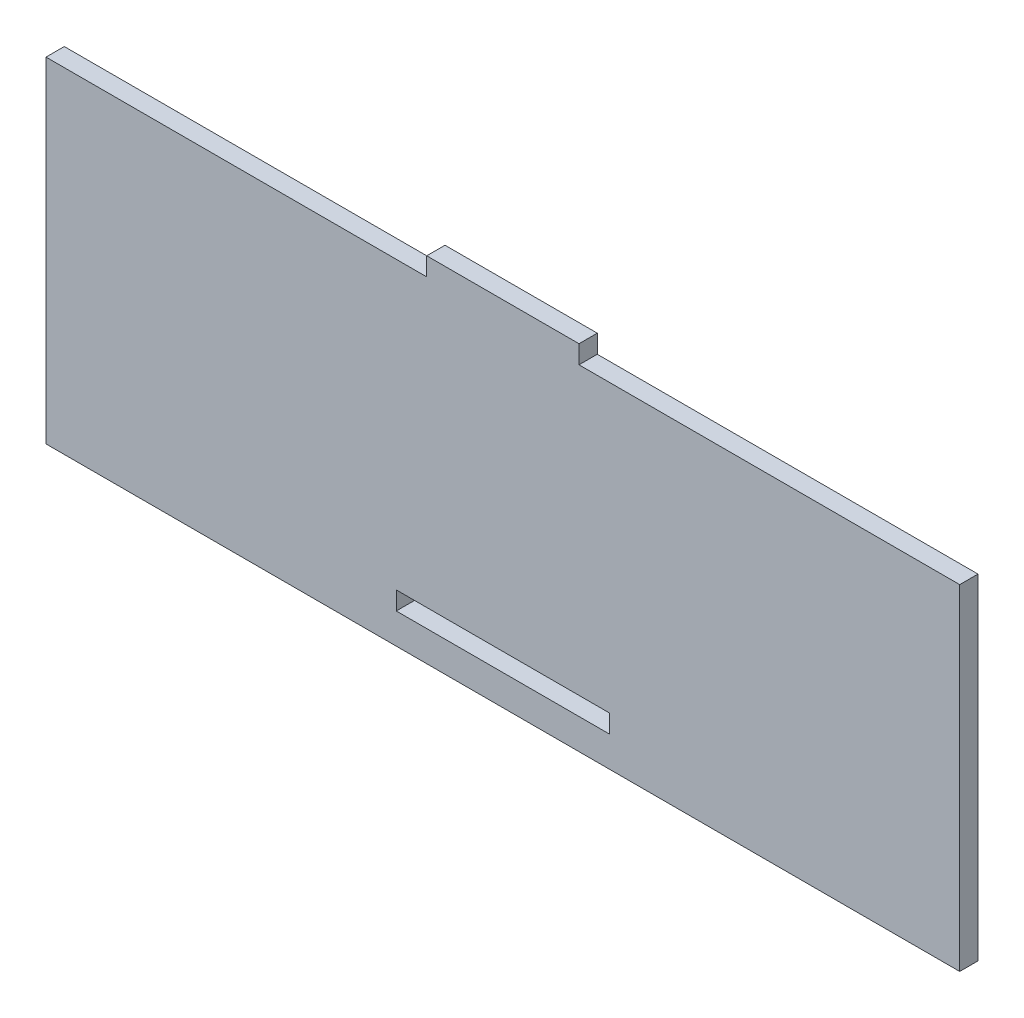
from build123d import *

# Parameters (mm, degrees)
SKETCH_1_W      = 35
SKETCH_1_H      = 3
EXTRUDE_1_DEPTH = 3


with BuildPart() as part:
    # Эскиз1 → Бобышка-Вытянуть1 (new body)
    with BuildSketch(Plane.XY):
        Polygon((14.215686275, 61.346405229), (76.715686275, 61.346405229), (76.715686275, 6.346405229), (-73.284313725, 6.346405229), (-73.284313725, 61.346405229), (-10.784313725, 61.346405229), (-10.784313725, 64.346405229), (14.215686275, 64.346405229), align=None)
        with Locations((1.715686275, 12.846405229)):
            Rectangle(SKETCH_1_W, SKETCH_1_H, mode=Mode.SUBTRACT)
    extrude(amount=EXTRUDE_1_DEPTH)


solid = part.part
